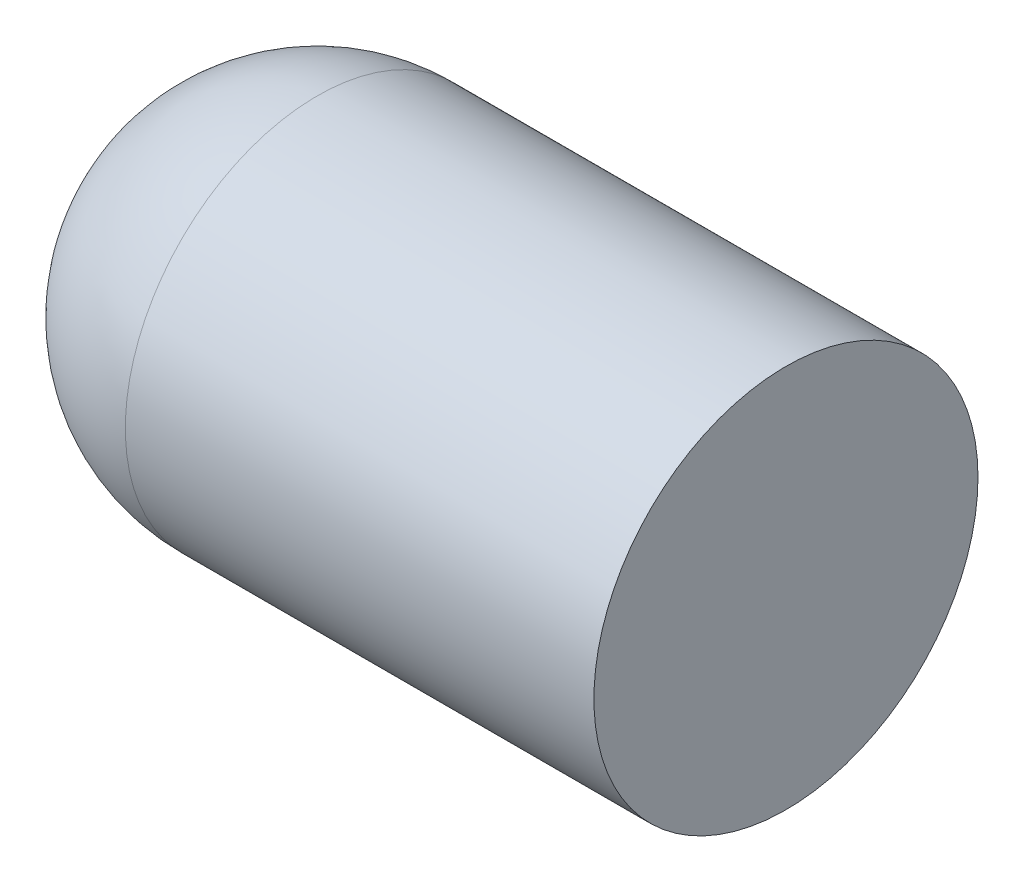
from build123d import *

# Parameters (mm, degrees)
REVOLVE1_ANGLE      = 180
SKETCH2_R           = 2.5
BOSS_EXTRUDE1_DEPTH = 6.1


with BuildPart() as part:
    # Sketch1 → Revolve1 (revolve)
    with BuildSketch(Plane(origin=(0, 0, 0), x_dir=(0, 0, -1), z_dir=(1, 0, 0))):
        with BuildLine():
            Line((0, -2.5), (0, 2.5))
            ThreePointArc((0, 2.5), (2.5, 0), (0, -2.5))
        make_face()
    revolve(axis=Axis((0, -2.5, 0), (0, 1, 0)), revolution_arc=REVOLVE1_ANGLE)

    # Sketch2 → Boss-Extrude1 (add)
    with BuildSketch(Plane(origin=(0, 0, 0), x_dir=(0, 0, -1), z_dir=(1, 0, 0))):
        Circle(SKETCH2_R)
    extrude(amount=BOSS_EXTRUDE1_DEPTH)


solid = part.part
